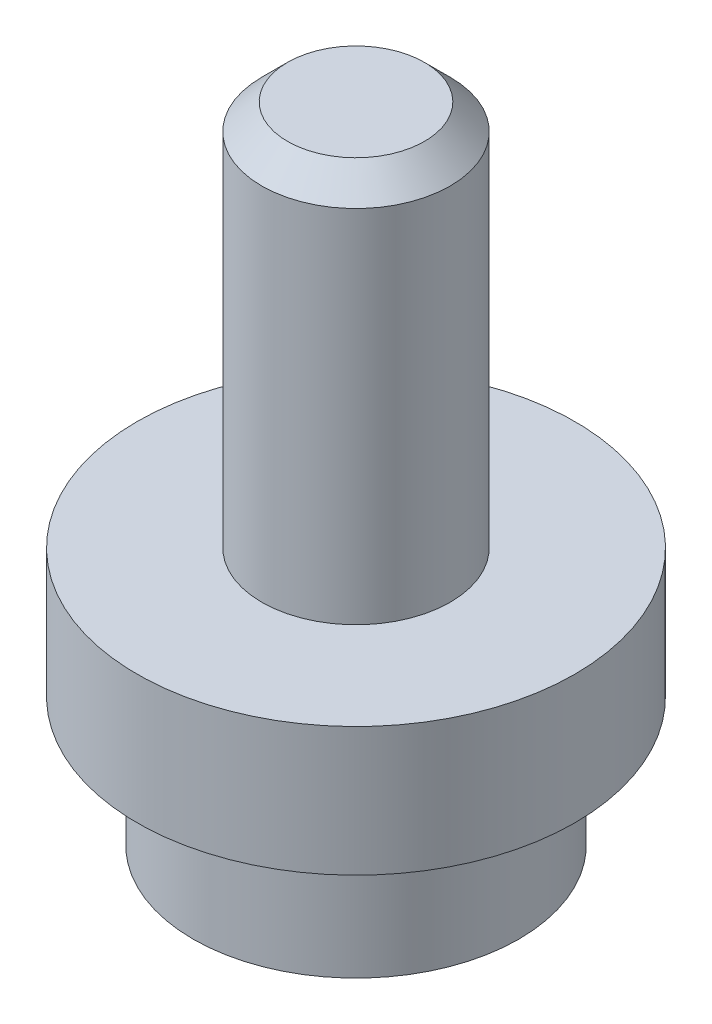
from build123d import *

# Parameters (mm, degrees)
CHAMFER_1_SIZE = 1


with BuildPart() as part:
    # 草图1 → 旋转1 (revolve)
    with BuildSketch(Plane.XY):
        Polygon((0, 0), (6.325, 0), (6.325, 5), (8.5, 5), (8.5, 10), (3.66, 10), (3.66, 25), (0, 25), align=None)
    revolve(axis=Axis((0, 25, 0), (0, 1, 0)))

    # 倒角1
    chamfer_1_edges = [part.edges().sort_by_distance(p)[0] for p in [
        (-3.66, 25, 0),
    ]]
    chamfer(chamfer_1_edges, length=CHAMFER_1_SIZE)


solid = part.part
